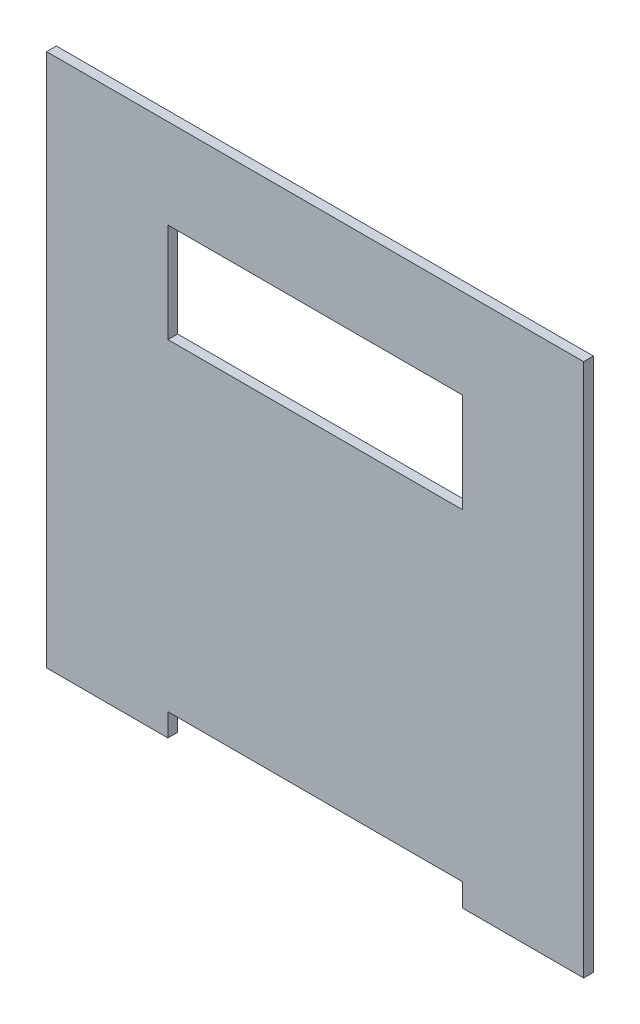
from build123d import *

# Parameters (mm, degrees)
ESQUISSE1_W             = 330
ESQUISSE1_H             = 328
BOSS_EXTRU_1_DEPTH      = 6
ESQUISSE2_W             = 181
ESQUISSE2_H             = 61
ESQUISSE2_H_2           = 14
ENL_V_MAT_EXTRU_1_DEPTH = 466.317096183


with BuildPart() as part:
    # Esquisse1 → Boss.-Extru.1 (new body)
    with BuildSketch(Plane.XY):
        with Locations((-165, 164)):
            Rectangle(ESQUISSE1_W, ESQUISSE1_H)
    extrude(amount=BOSS_EXTRU_1_DEPTH)

    # Esquisse2 → Enlèv. mat.-Extru.1 (cut, through all)
    with BuildSketch(Plane(origin=(0, 0, 0), x_dir=(-1, 0, 0), z_dir=(0, 0, -1))):
        with Locations((165, 242.5)):
            Rectangle(ESQUISSE2_W, ESQUISSE2_H)
        with Locations((165, 7)):
            Rectangle(ESQUISSE2_W, ESQUISSE2_H_2)
    extrude(amount=-ENL_V_MAT_EXTRU_1_DEPTH, mode=Mode.SUBTRACT)


solid = part.part
